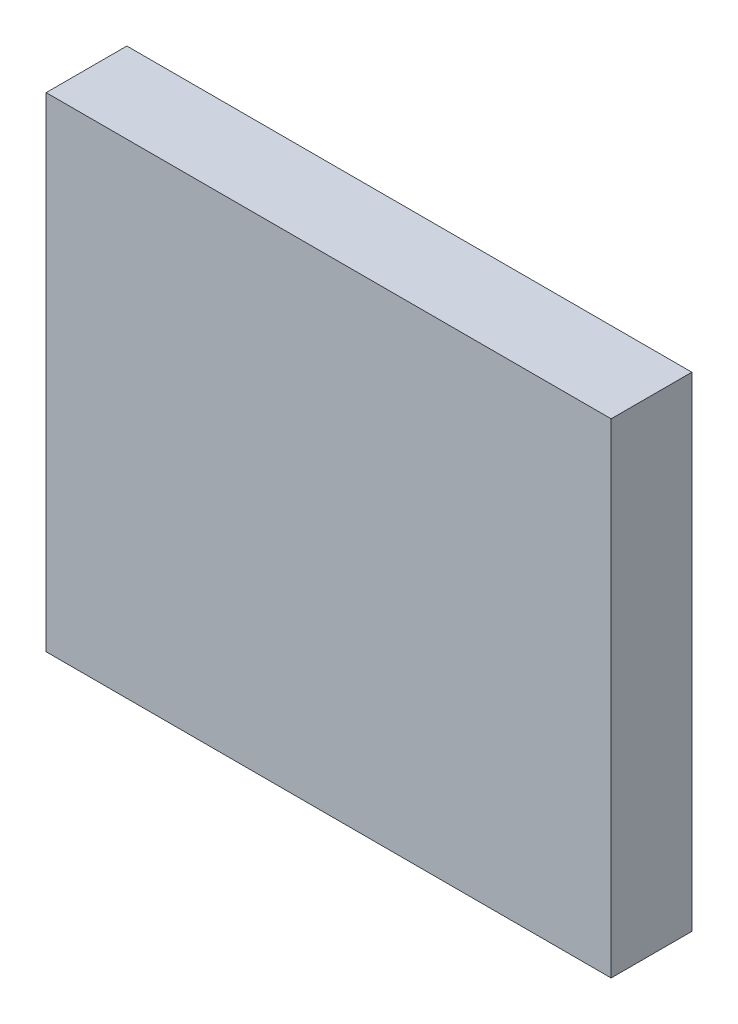
from build123d import *

# Parameters (mm, degrees)
ESQUISSE1_W          = 70
ESQUISSE1_H          = 60
BASE_EXTRUSION_DEPTH = 10


with BuildPart() as part:
    # Esquisse1 → Base-Extrusion (new body)
    with BuildSketch(Plane.XY):
        with Locations((12.536901408, 13.68084507)):
            Rectangle(ESQUISSE1_W, ESQUISSE1_H)
    extrude(amount=BASE_EXTRUSION_DEPTH)


solid = part.part
